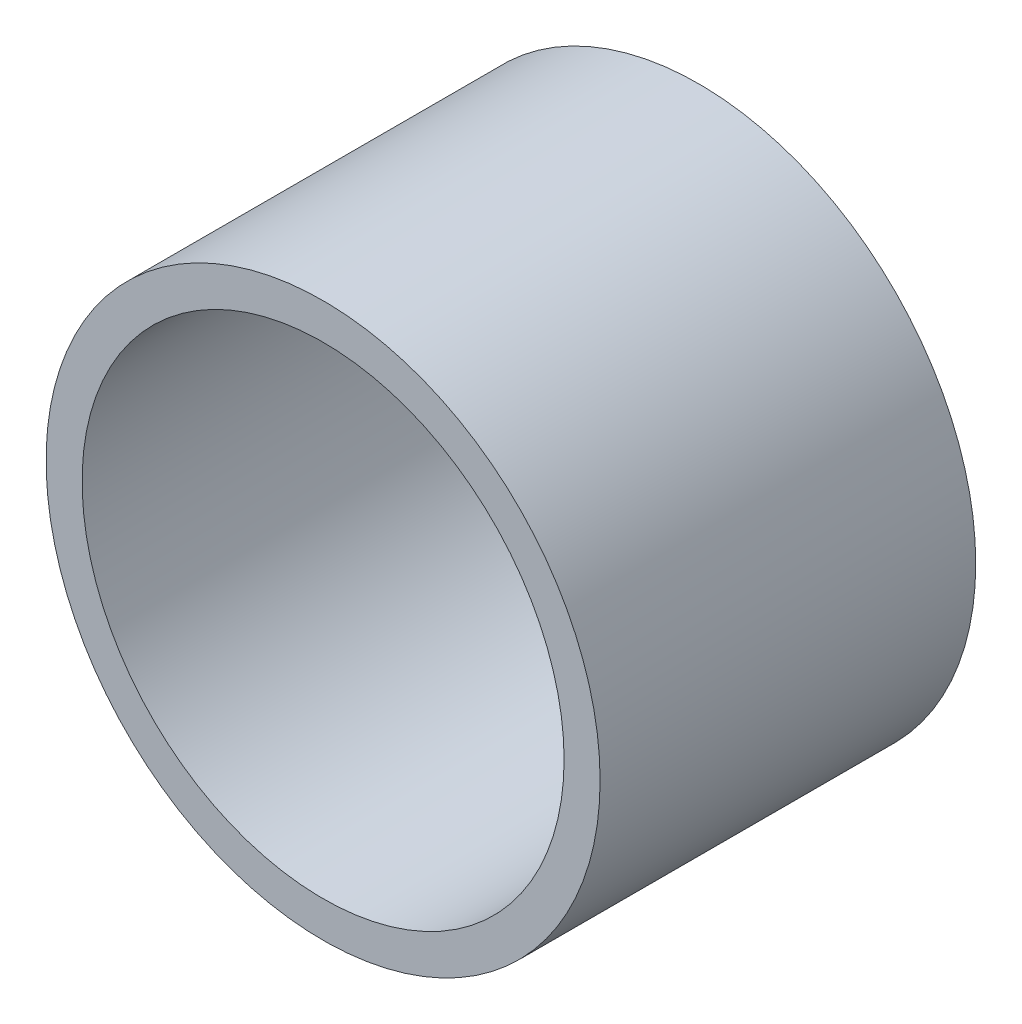
from build123d import *

# Parameters (mm, degrees)
SKETCH1_R           = 50
SKETCH1_R_2         = 43.5
BOSS_EXTRUDE1_DEPTH = 67.8


with BuildPart() as part:
    # Sketch1 → Boss-Extrude1 (new body)
    with BuildSketch(Plane.XY):
        Circle(SKETCH1_R)
        Circle(SKETCH1_R_2, mode=Mode.SUBTRACT)
    extrude(amount=BOSS_EXTRUDE1_DEPTH)


solid = part.part
